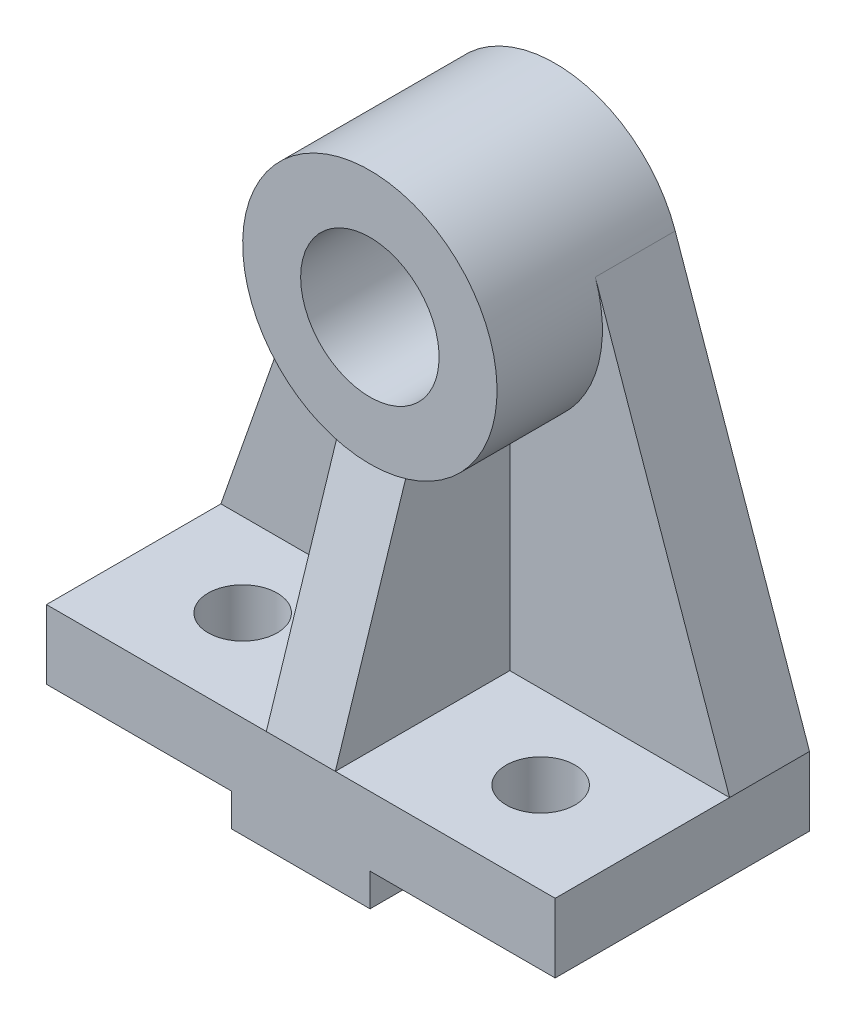
from build123d import *

# Parameters (mm, degrees)
SKETCH1_W           = 140
SKETCH1_H           = 70
BOSS_EXTRUDE1_DEPTH = 19
SKETCH2_W           = 38.1
SKETCH2_H           = 9
BOSS_EXTRUDE2_DEPTH = 70
SKETCH3_R           = 9.5
CUT_EXTRUDE1_DEPTH  = 84.120394609
SKETCH4_R           = 35
SKETCH4_R_2         = 19.05
BOSS_EXTRUDE3_DEPTH = 51
BOSS_EXTRUDE4_DEPTH = 22
RIB5_REACH          = 169.419
SKETCH10_WALL_W     = 398.82114278
SKETCH10_WALL_H     = 19


with BuildPart() as part:
    # Sketch1 → Boss-Extrude1 (new body)
    with BuildSketch(Plane(origin=(0, 0, 0), x_dir=(1, 0, 0), z_dir=(0, 1, 0))):
        Rectangle(SKETCH1_W, SKETCH1_H)
    extrude(amount=BOSS_EXTRUDE1_DEPTH)

    # Sketch2 → Boss-Extrude2 (add)
    with BuildSketch(Plane.XY.offset(35)):
        with Locations((0, -4.5)):
            Rectangle(SKETCH2_W, SKETCH2_H)
    extrude(amount=-BOSS_EXTRUDE2_DEPTH)

    # Sketch3 → Cut-Extrude1 (cut, through all)
    with BuildSketch(Plane(origin=(0, 19, 0), x_dir=(1, 0, 0), z_dir=(0, 1, 0))):
        with Locations(Location((41, -10, 0), (0, 0, 270))):
            Circle(SKETCH3_R)
        with Locations(Location((-41, -10, 0), (0, 0, 270))):
            Circle(SKETCH3_R)
    extrude(amount=-CUT_EXTRUDE1_DEPTH, mode=Mode.SUBTRACT)



with BuildPart() as body_2:
    # Sketch4 → Boss-Extrude3 (new body)
    with BuildSketch(Plane(origin=(0, 0, -35), x_dir=(-1, 0, 0), z_dir=(0, 0, -1))):
        with Locations((0, 113)):
            Circle(SKETCH4_R)
        with Locations((0, 113)):
            Circle(SKETCH4_R_2, mode=Mode.SUBTRACT)
    extrude(amount=-BOSS_EXTRUDE3_DEPTH)


with BuildPart() as part_1:
    add(part.part)

    add(body_2.part)  # Boss-Extrude4 merges body 2
    # Sketch7 → Boss-Extrude4 (add)
    with BuildSketch(Plane(origin=(0, 0, -35), x_dir=(-1, 0, 0), z_dir=(0, 0, -1))):
        with BuildLine():
            Line((-70, 19), (-33.033269752, 124.567328538))
            ThreePointArc((-33.033269752, 124.567328538), (0, 78), (33.033269752, 124.567328538))
            Line((33.033269752, 124.567328538), (70, 19))
            Line((70, 19), (-70, 19))
        make_face()
    extrude(amount=-BOSS_EXTRUDE4_DEPTH)

    # Sketch10 wall → Rib5 (add, up to next)
    with BuildSketch(Plane(origin=(0, 48.5, 25.5), x_dir=(0, 0.951860557857, -0.306531366089), z_dir=(0, 0.306531366089, 0.951860557857)), mode=Mode.PRIVATE) as rib5_sk1:
        Rectangle(SKETCH10_WALL_W, SKETCH10_WALL_H)
    rib5_tool1 = extrude(rib5_sk1.sketch, amount=-RIB5_REACH, mode=Mode.PRIVATE) - part_1.part
    add(rib5_tool1.solids().sort_by_distance((0, 48.5, 25.5))[0])


solid = part_1.part
